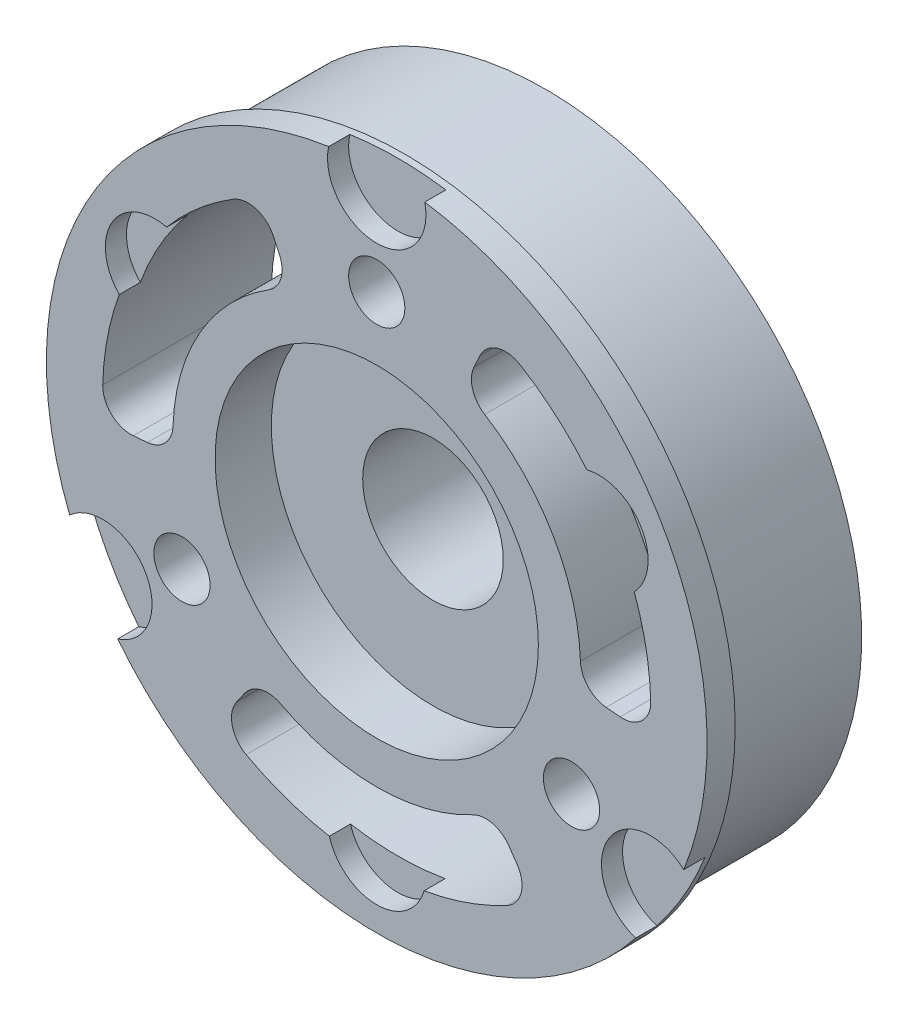
from build123d import *

# Parameters (mm, degrees)
SKETCH_1_R          = 23.5
EXTRUDE_1_DEPTH     = 2
SKETCH_2_R          = 22.5
EXTRUDE_2_DEPTH     = 10
SKETCH_3_R          = 2
CUT_EXTRUDE_1_DEPTH = 14
SKETCH_5_R          = 5
CUT_EXTRUDE_2_DEPTH = 14
CUT_EXTRUDE_3_DEPTH = 14
FILLET_1_R          = 2
SKETCH_7_R          = 3.5
CUT_EXTRUDE_4_DEPTH = 1.5
SKETCH_8_R          = 11.5
CUT_EXTRUDE_5_DEPTH = 4


with BuildPart() as part:
    # 草图1 → 凸台-拉伸1 (new body)
    with BuildSketch(Plane.XY):
        Circle(SKETCH_1_R)
    extrude(amount=EXTRUDE_1_DEPTH)

    # 草图2 → 凸台-拉伸2 (add)
    with BuildSketch(Plane(origin=(0, 0, 0), x_dir=(-1, 0, 0), z_dir=(0, 0, -1))):
        Circle(SKETCH_2_R)
    extrude(amount=EXTRUDE_2_DEPTH)

    # 草图3 → 切除-拉伸1 (cut)
    with BuildSketch(Plane(origin=(0, 0, -10), x_dir=(-1, 0, 0), z_dir=(0, 0, -1))):
        with Locations((0, 16)):
            Circle(SKETCH_3_R)
        with Locations((13.856406461, -8)):
            Circle(SKETCH_3_R)
        with Locations((-13.856406461, -8)):
            Circle(SKETCH_3_R)
    extrude(amount=-CUT_EXTRUDE_1_DEPTH, mode=Mode.SUBTRACT)

    # 草图5 → 切除-拉伸2 (cut)
    with BuildSketch(Plane(origin=(0, 0, -10), x_dir=(-1, 0, 0), z_dir=(0, 0, -1))):
        Circle(SKETCH_5_R)
    extrude(amount=-CUT_EXTRUDE_2_DEPTH, mode=Mode.SUBTRACT)

    # 草图6 → 切除-拉伸3 (cut)
    with BuildSketch(Plane(origin=(0, 0, -10), x_dir=(-1, 0, 0), z_dir=(0, 0, -1))):
        with BuildLine():
            Line((8.241056104, 17.673001847), (6.127964795, 13.141462912))
            ThreePointArc((6.127964795, 13.141462912), (12.229175964, 7.790844321), (14.5, 0))
            ThreePointArc((14.5, 0), (14.486199213, -0.632481117), (14.444823122, -1.26375827))
            Line((14.444823122, -1.26375827), (19.425796613, -1.699536984))
            ThreePointArc((19.425796613, -1.699536984), (19.481440321, -0.850578054), (19.5, 0))
            ThreePointArc((19.5, 0), (16.446133193, 10.477342363), (8.241056104, 17.673001847))
        make_face()
        with BuildLine():
            Line((11.184740509, -15.973464864), (8.316858327, -11.877704642))
            ThreePointArc((8.316858327, -11.877704642), (0, -14.5), (-8.316858327, -11.877704642))
            Line((-8.316858327, -11.877704642), (-11.184740509, -15.973464864))
            ThreePointArc((-11.184740509, -15.973464864), (0, -19.5), (11.184740509, -15.973464864))
        make_face()
        with BuildLine():
            Line((-19.425796613, -1.699536984), (-14.444823122, -1.26375827))
            ThreePointArc((-14.444823122, -1.26375827), (-12.557368355, 7.25), (-6.127964795, 13.141462912))
            Line((-6.127964795, 13.141462912), (-8.241056104, 17.673001847))
            ThreePointArc((-8.241056104, 17.673001847), (-16.887495374, 9.75), (-19.425796613, -1.699536984))
        make_face()
    extrude(amount=-CUT_EXTRUDE_3_DEPTH, mode=Mode.SUBTRACT)

    # 圆角1
    fillet_1_edges = [part.edges().sort_by_distance(p)[0] for p in [
        (8.241056104, 17.673001847, -4),
        (6.127964795, 13.141462912, -4),
        (14.444823122, -1.26375827, -4),
        (19.425796613, -1.699536984, -4),
        (11.184740509, -15.973464864, -4),
        (8.316858327, -11.877704642, -4),
        (-8.316858327, -11.877704642, -4),
        (-11.184740509, -15.973464864, -4),
        (-19.425796613, -1.699536984, -4),
        (-14.444823122, -1.26375827, -4),
        (-6.127964795, 13.141462912, -4),
        (-8.241056104, 17.673001847, -4),
    ]]
    fillet(fillet_1_edges, radius=FILLET_1_R)

    # 草图7 → 切除-拉伸4 (cut)
    with BuildSketch(Plane.XY.offset(2)):
        with Locations((0, 22.5)):
            Circle(SKETCH_7_R)
        with Locations((19.485571585, -11.25)):
            Circle(SKETCH_7_R)
        with Locations((-19.485571585, -11.25)):
            Circle(SKETCH_7_R)
        with Locations((15.804963619, 9.125)):
            Circle(SKETCH_7_R)
        with Locations((0, -18.25)):
            Circle(SKETCH_7_R)
        with Locations((-15.804963619, 9.125)):
            Circle(SKETCH_7_R)
    extrude(amount=-CUT_EXTRUDE_4_DEPTH, mode=Mode.SUBTRACT)

    # 草图8 → 切除-拉伸5 (cut)
    with BuildSketch(Plane.XY.offset(2)):
        Circle(SKETCH_8_R)
    extrude(amount=-CUT_EXTRUDE_5_DEPTH, mode=Mode.SUBTRACT)


solid = part.part
